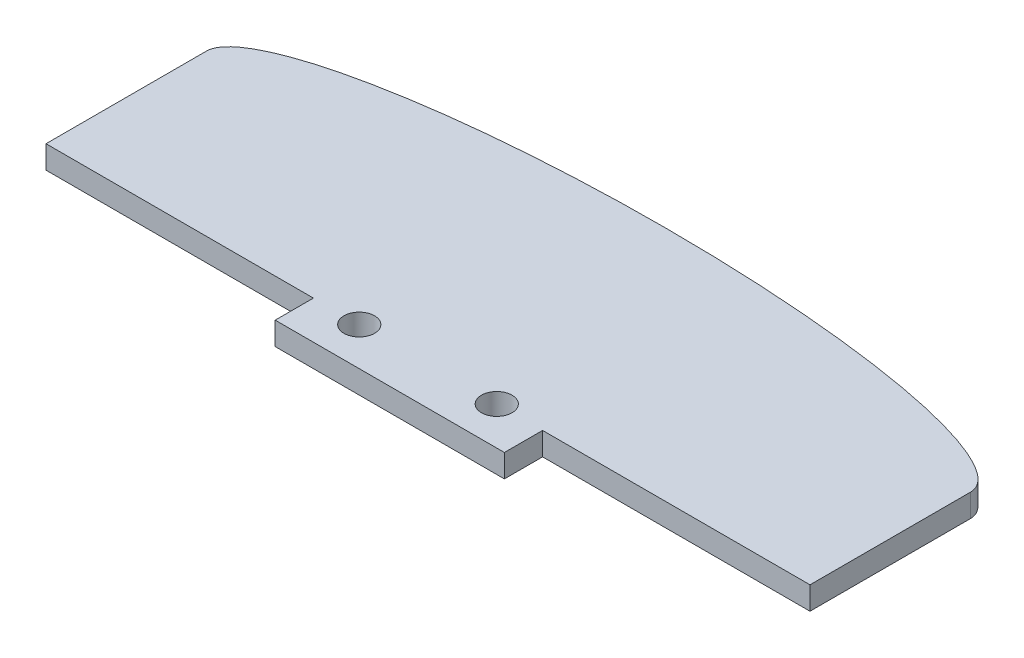
from build123d import *

# Parameters (mm, degrees)
SKETCH1_R           = 2
BOSS_EXTRUDE1_DEPTH = 3


with BuildPart() as part:
    # Sketch1 → Boss-Extrude1 (new body)
    with BuildSketch(Plane(origin=(0, 0, 0), x_dir=(1, 0, 0), z_dir=(0, 1, 0))):
        with BuildLine():
            Line((50, 10.5), (50, -10.5))
            Line((50, -10.5), (15, -10.5))
            Line((15, -10.5), (15, -15.5))
            Line((15, -15.5), (-15, -15.5))
            Line((-15, -15.5), (-15, -10.5))
            Line((-15, -10.5), (-50, -10.5))
            Line((-50, -10.5), (-50, 10.5))
            add(Edge.make_bspline(
                [(50, 10.5), (50.00000432, 20.5), (2.116e-06, 20.5), (-50.000000088, 20.5), (-50, 10.5)],
                knots=[3.141592565, 3.141592565, 3.141592565, 4.712388936, 4.712388936, 6.283185307, 6.283185307, 6.283185307], degree=2, weights=[1, 0.707106766, 1, 0.707106766, 1]))
        make_face()
        with Locations(Location((-9, -10.5, 0), (0, 0, 270))):
            Circle(SKETCH1_R, mode=Mode.SUBTRACT)
        with Locations(Location((9, -10.5, 0), (0, 0, 270))):
            Circle(SKETCH1_R, mode=Mode.SUBTRACT)
    extrude(amount=BOSS_EXTRUDE1_DEPTH)


solid = part.part
